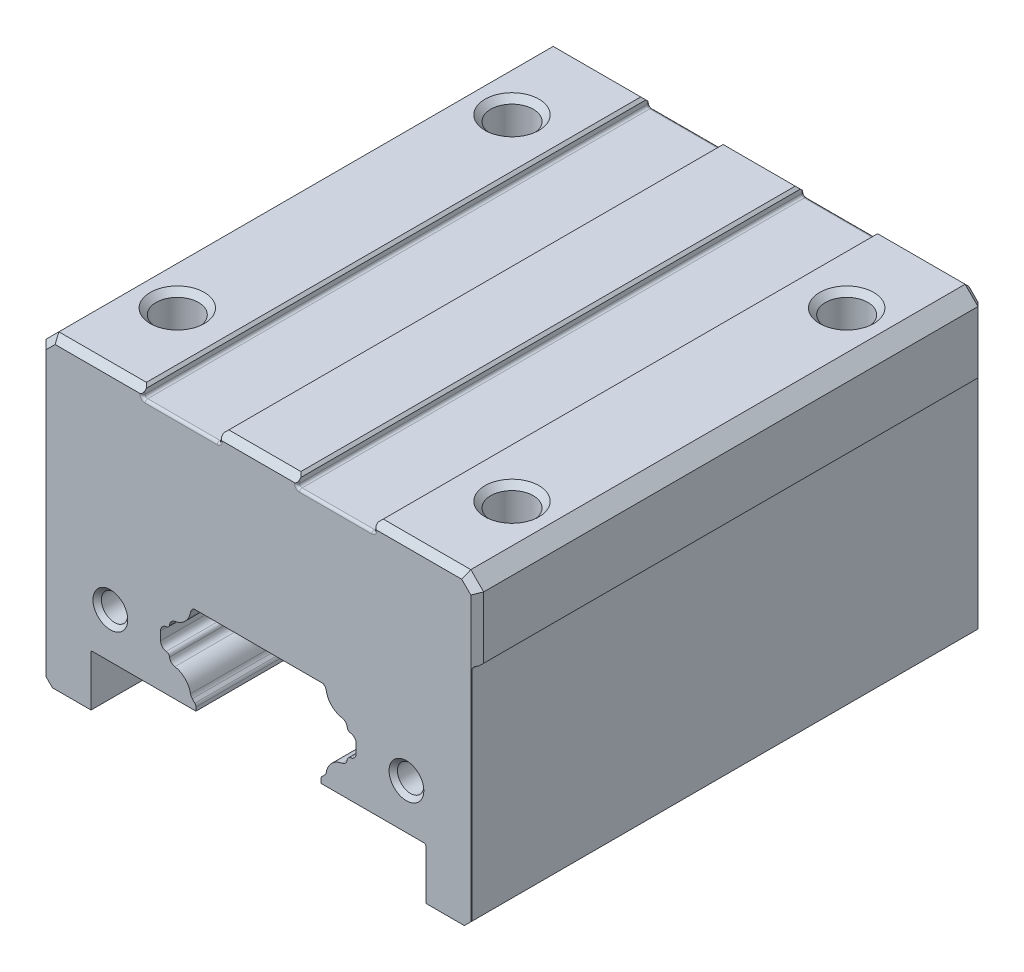
from build123d import *

# Parameters (mm, degrees)
BLOCK_BODY_DEPTH                       = 19.7
SIDE_REFERENCE_SKETCH_W                = 40
SIDE_REFERENCE_SKETCH_H                = 20
SIDE_REFERENCE_DEPTH                   = 0.45
AESTHETIC_CHAMFER_1_SIZE               = 0.5
CASTING_GROOVE_SKETCH_W                = 6
CASTING_GROOVE_SKETCH_H                = 40
CASTING_GOORVE_DEPTH                   = 0.75
AESTHETIC_CHAMFER_2_SIZE               = 0.2
PRODUCTION_FILLET_R                    = 0.2
FIXING_HOLES_D                         = 3.3
FIXING_HOLES_DEPTH                     = 7.1
FIXING_HOLES_CSINK_D                   = 4.2
FIXING_HOLES_CSINK_ANGLE               = 90
FIXING_HOLES_TIP                       = 0.991420021
END_CAP_FIXING_HOLES_FRONT_D           = 2.05
END_CAP_FIXING_HOLES_FRONT_DEPTH       = 6.35
END_CAP_FIXING_HOLES_FRONT_CSINK_D     = 2.7
END_CAP_FIXING_HOLES_FRONT_CSINK_ANGLE = 90
END_CAP_FIXING_HOLES_FRONT_TIP         = 0.615882135
END_CAP_FIXING_HOLES_BACK_D            = 2.05
END_CAP_FIXING_HOLES_BACK_DEPTH        = 6.35
END_CAP_FIXING_HOLES_BACK_CSINK_D      = 2.7
END_CAP_FIXING_HOLES_BACK_CSINK_ANGLE  = 90
END_CAP_FIXING_HOLES_BACK_TIP          = 0.615882135


with BuildPart() as part:
    # Block Profile → Block Body (new, symmetric)
    with BuildSketch(Plane.XY):
        with BuildLine():
            Line((16, 4.3), (13, 4.3))
            Line((13, 4.3), (13, 8.2))
            ThreePointArc((13, 8.2), (12.970710678, 8.270710678), (12.9, 8.3))
            Line((12.9, 8.3), (4.85, 8.3))
            Line((4.85, 8.3), (4.85, 8.584314575))
            ThreePointArc((4.85, 8.584314575), (4.87283614, 8.699119605), (4.937867966, 8.796446609))
            Line((4.937867966, 8.796446609), (5.13367604, 8.992254684))
            ThreePointArc((5.13367604, 8.992254684), (5.223715255, 9.115101334), (5.272591987, 9.259356056))
            ThreePointArc((5.272591987, 9.259356056), (5.689339828, 10.060660172), (6.490643944, 10.477408013))
            ThreePointArc((6.490643944, 10.477408013), (6.766607459, 10.625414027), (6.900414725, 10.908534598))
            ThreePointArc((6.900414725, 10.908534598), (6.98601637, 11.08386098), (7.161342753, 11.169462626))
            ThreePointArc((7.161342753, 11.169462626), (7.474614052, 11.334529402), (7.6, 11.665685425))
            Line((7.6, 11.665685425), (7.6, 12.334314575))
            ThreePointArc((7.6, 12.334314575), (7.474614052, 12.665470598), (7.161342753, 12.830537374))
            ThreePointArc((7.161342753, 12.830537374), (6.98601637, 12.91613902), (6.900414725, 13.091465402))
            ThreePointArc((6.900414725, 13.091465402), (6.766607459, 13.374585973), (6.490643944, 13.522591987))
            ThreePointArc((6.490643944, 13.522591987), (5.689339828, 13.939339828), (5.272591987, 14.740643944))
            ThreePointArc((5.272591987, 14.740643944), (5.223715255, 14.884898666), (5.13367604, 15.007745316))
            Line((5.13367604, 15.007745316), (5.041421356, 15.1))
            Line((5.041421356, 15.1), (-5.041421356, 15.1))
            Line((-5.041421356, 15.1), (-5.13367604, 15.007745316))
            ThreePointArc((-5.13367604, 15.007745316), (-5.223715255, 14.884898666), (-5.272591987, 14.740643944))
            ThreePointArc((-5.272591987, 14.740643944), (-5.689339828, 13.939339828), (-6.490643944, 13.522591987))
            ThreePointArc((-6.490643944, 13.522591987), (-6.766607459, 13.374585973), (-6.900414725, 13.091465402))
            ThreePointArc((-6.900414725, 13.091465402), (-6.98601637, 12.91613902), (-7.161342753, 12.830537374))
            ThreePointArc((-7.161342753, 12.830537374), (-7.474614052, 12.665470598), (-7.6, 12.334314575))
            Line((-7.6, 12.334314575), (-7.6, 11.665685425))
            ThreePointArc((-7.6, 11.665685425), (-7.474614052, 11.334529402), (-7.161342753, 11.169462626))
            ThreePointArc((-7.161342753, 11.169462626), (-6.98601637, 11.08386098), (-6.900414725, 10.908534598))
            ThreePointArc((-6.900414725, 10.908534598), (-6.766607459, 10.625414027), (-6.490643944, 10.477408013))
            ThreePointArc((-6.490643944, 10.477408013), (-5.689339828, 10.060660172), (-5.272591987, 9.259356056))
            ThreePointArc((-5.272591987, 9.259356056), (-5.223715255, 9.115101334), (-5.13367604, 8.992254684))
            Line((-5.13367604, 8.992254684), (-4.937867966, 8.796446609))
            ThreePointArc((-4.937867966, 8.796446609), (-4.87283614, 8.699119605), (-4.85, 8.584314575))
            Line((-4.85, 8.584314575), (-4.85, 8.3))
            Line((-4.85, 8.3), (-12.9, 8.3))
            ThreePointArc((-12.9, 8.3), (-12.970710678, 8.270710678), (-13, 8.2))
            Line((-13, 8.2), (-13, 4.3))
            Line((-13, 4.3), (-16, 4.3))
            Line((-16, 4.3), (-17, 5.3))
            Line((-17, 5.3), (-17, 27))
            Line((-17, 27), (-16, 28))
            Line((-16, 28), (16, 28))
            Line((16, 28), (17, 27))
            Line((17, 27), (17, 5.3))
            Line((17, 5.3), (16, 4.3))
        make_face()
    extrude(amount=BLOCK_BODY_DEPTH, both=True)

    # Side Reference Sketch → Side Reference (cut)
    with BuildSketch(Plane(origin=(17, 0, 0), x_dir=(0, 0, -1), z_dir=(1, 0, 0))):
        with Locations((0, 12)):
            Rectangle(SIDE_REFERENCE_SKETCH_W, SIDE_REFERENCE_SKETCH_H)
    extrude(amount=-SIDE_REFERENCE_DEPTH, mode=Mode.SUBTRACT)

    # Aesthetic Chamfer 1
    aesthetic_chamfer_1_edges = [part.edges().sort_by_distance(p)[0] for p in [
        (-17, 16.15, -19.7),
        (-16.5, 27.5, -19.7),
        (0, 28, -19.7),
        (16.5, 27.5, -19.7),
        (17, 24.5, -19.7),
        (-17, 16.15, 19.7),
        (-16.5, 27.5, 19.7),
        (17, 24.5, 19.7),
        (16.5, 27.5, 19.7),
        (0, 28, 19.7),
    ]]
    chamfer(aesthetic_chamfer_1_edges, length=AESTHETIC_CHAMFER_1_SIZE)

    # Casting Groove Sketch → Casting Goorve (cut)
    with BuildSketch(Plane(origin=(0, 28, 0), x_dir=(1, 0, 0), z_dir=(0, 1, 0))):
        with Locations((-6, 0)):
            Rectangle(CASTING_GROOVE_SKETCH_W, CASTING_GROOVE_SKETCH_H)
        with Locations((6, 0)):
            Rectangle(CASTING_GROOVE_SKETCH_W, CASTING_GROOVE_SKETCH_H)
    extrude(amount=-CASTING_GOORVE_DEPTH, mode=Mode.SUBTRACT)

    # Aesthetic Chamfer 2
    aesthetic_chamfer_2_edges = [part.edges().sort_by_distance(p)[0] for p in [
        (17, 22, 0),
        (-9, 28, 0),
        (-3, 28, 0),
        (3, 28, 0),
        (9, 28, 0),
    ]]
    chamfer(aesthetic_chamfer_2_edges, length=AESTHETIC_CHAMFER_2_SIZE)

    # Production Fillet
    production_fillet_edges = [part.edges().sort_by_distance(p)[0] for p in [
        (16.55, 22, 0),
        (6, 27.25, -19.7),
        (-6, 27.25, -19.7),
        (-3, 27.375, -19.7),
        (-3, 27.375, 19.7),
        (-3, 27.25, 0),
        (-9, 27.375, -19.7),
        (-9, 27.25, 0),
        (-9, 27.375, 19.7),
        (-6, 27.25, 19.7),
        (9, 27.375, -19.7),
        (9, 27.375, 19.7),
        (9, 27.25, 0),
        (3, 27.375, -19.7),
        (3, 27.25, 0),
        (3, 27.375, 19.7),
        (6, 27.25, 19.7),
    ]]
    fillet(production_fillet_edges, radius=PRODUCTION_FILLET_R)

    # Fixing Holes
    with Locations(Plane(origin=(0, 28, 0), x_dir=(1, 0, 0), z_dir=(0, 1, 0))):
        with Locations((-13, -13), (-13, 13), (13, 13), (13, -13)):
            CounterSinkHole(FIXING_HOLES_D / 2, FIXING_HOLES_CSINK_D / 2, depth=FIXING_HOLES_DEPTH, counter_sink_angle=FIXING_HOLES_CSINK_ANGLE)
            with Locations((0, 0, -(FIXING_HOLES_DEPTH + FIXING_HOLES_TIP / 2))):  # 118° drill point
                Cone(0, FIXING_HOLES_D / 2, FIXING_HOLES_TIP, mode=Mode.SUBTRACT)

    # End Cap Fixing Holes Front
    with Locations(Plane.XY.offset(19.7)):
        with Locations((-11.5, 11.8), (11.5, 11.8)):
            CounterSinkHole(END_CAP_FIXING_HOLES_FRONT_D / 2, END_CAP_FIXING_HOLES_FRONT_CSINK_D / 2, depth=END_CAP_FIXING_HOLES_FRONT_DEPTH, counter_sink_angle=END_CAP_FIXING_HOLES_FRONT_CSINK_ANGLE)
            with Locations((0, 0, -(END_CAP_FIXING_HOLES_FRONT_DEPTH + END_CAP_FIXING_HOLES_FRONT_TIP / 2))):  # 118° drill point
                Cone(0, END_CAP_FIXING_HOLES_FRONT_D / 2, END_CAP_FIXING_HOLES_FRONT_TIP, mode=Mode.SUBTRACT)

    # End Cap Fixing Holes Back
    with Locations(Plane(origin=(0, 0, -19.7), x_dir=(-1, 0, 0), z_dir=(0, 0, -1))):
        with Locations((-11.5, 11.8), (11.5, 11.8)):
            CounterSinkHole(END_CAP_FIXING_HOLES_BACK_D / 2, END_CAP_FIXING_HOLES_BACK_CSINK_D / 2, depth=END_CAP_FIXING_HOLES_BACK_DEPTH, counter_sink_angle=END_CAP_FIXING_HOLES_BACK_CSINK_ANGLE)
            with Locations((0, 0, -(END_CAP_FIXING_HOLES_BACK_DEPTH + END_CAP_FIXING_HOLES_BACK_TIP / 2))):  # 118° drill point
                Cone(0, END_CAP_FIXING_HOLES_BACK_D / 2, END_CAP_FIXING_HOLES_BACK_TIP, mode=Mode.SUBTRACT)


solid = part.part
